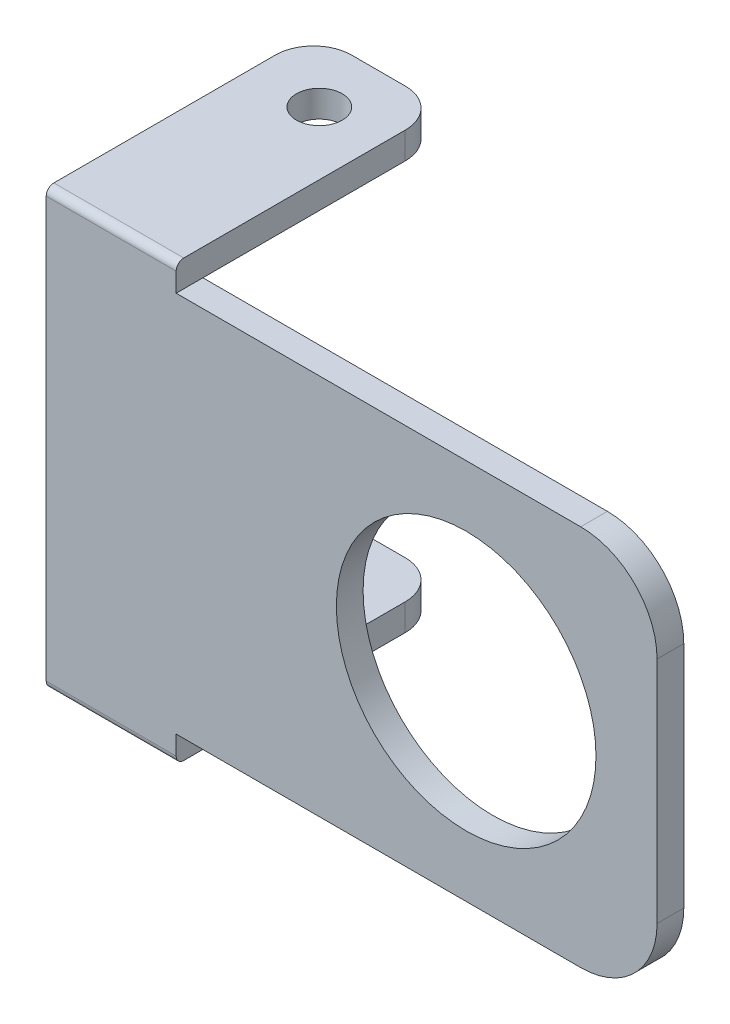
from build123d import *

# Parameters (mm, degrees)
SKETCH_1_W          = 80
SKETCH_1_H          = 50
EXTRUDE_1_DEPTH     = 3.5
CUT_EXTRUDE_1_DEPTH = 3
SKETCH_12_W         = 17.020417597
SKETCH_12_H         = 35
EXTRUDE_2_DEPTH     = 3.5
FILLET_1_R          = 1
FILLET_2_R          = 5
SKETCH_13_R         = 3
CUT_EXTRUDE_2_DEPTH = 10
SKETCH_14_R         = 17
CUT_EXTRUDE_3_DEPTH = 8
FILLET_3_R          = 10


with BuildPart() as part:
    # 草图1 → 凸台-拉伸1 (new body)
    with BuildSketch(Plane.XY):
        Rectangle(SKETCH_1_W, SKETCH_1_H)
    extrude(amount=EXTRUDE_1_DEPTH)

    # 草图2 → 切除-拉伸1 (cut)
    with BuildSketch(Plane(origin=(0, 0, 0), x_dir=(-1, 0, 0), z_dir=(0, 0, -1))):
        with BuildLine():
            Line((27.979582403, -12.4), (27.983580804, 12.6))
            ThreePointArc((27.983580804, 12.6), (22.879562421, 17.602998701), (17.979582403, 12.4))
            Line((17.979582403, 12.4), (17.979582403, -12.4))
            ThreePointArc((17.979582403, -12.4), (22.979582403, -17.4), (27.979582403, -12.4))
        make_face()
    extrude(amount=-CUT_EXTRUDE_1_DEPTH, mode=Mode.SUBTRACT)

    # 草图12 → 凸台-拉伸2 (add)
    with BuildSketch(Plane(origin=(0, 25, 0), x_dir=(1, 0, 0), z_dir=(0, 1, 0))):
        with Locations((-31.489791202, 14)):
            Rectangle(SKETCH_12_W, SKETCH_12_H)
    extrude_2 = extrude(amount=EXTRUDE_2_DEPTH)

    # 镜向1: 凸台-拉伸2 across plane
    add(extrude_2.mirror(Plane.ZX))

    # 圆角1
    fillet_1_edges = [part.edges().sort_by_distance(p)[0] for p in [
        (-31.489791201, 28.5, 3.5),
        (-31.489791201, -28.5, 3.5),
    ]]
    fillet(fillet_1_edges, radius=FILLET_1_R)

    # 圆角2
    fillet_2_edges = [part.edges().sort_by_distance(p)[0] for p in [
        (-22.979582403, -26.75, -31.5),
        (-40, -26.75, -31.5),
        (-40, 26.75, -31.5),
        (-22.979582403, 26.75, -31.5),
    ]]
    fillet(fillet_2_edges, radius=FILLET_2_R)

    # 草图13 → 切除-拉伸2 (cut)
    with BuildSketch(Plane(origin=(0, 28.5, 0), x_dir=(1, 0, 0), z_dir=(0, 1, 0))):
        with Locations(Location((-31.229582403, 23.5, 0), (0, 0, 270))):
            Circle(SKETCH_13_R)
    cut_extrude_2 = extrude(amount=-CUT_EXTRUDE_2_DEPTH, mode=Mode.SUBTRACT)

    # 镜向2: 切除-拉伸2 across plane
    add(cut_extrude_2.mirror(Plane.ZX), mode=Mode.SUBTRACT)

    # 草图14 → 切除-拉伸3 (cut)
    with BuildSketch(Plane(origin=(0, 0, 0), x_dir=(-1, 0, 0), z_dir=(0, 0, -1))):
        with Locations((-15, 0)):
            Circle(SKETCH_14_R)
    extrude(amount=-CUT_EXTRUDE_3_DEPTH, mode=Mode.SUBTRACT)

    # 圆角3
    fillet_3_edges = [part.edges().sort_by_distance(p)[0] for p in [
        (40, -25, 1.75),
        (40, 25, 1.75),
    ]]
    fillet(fillet_3_edges, radius=FILLET_3_R)


solid = part.part
